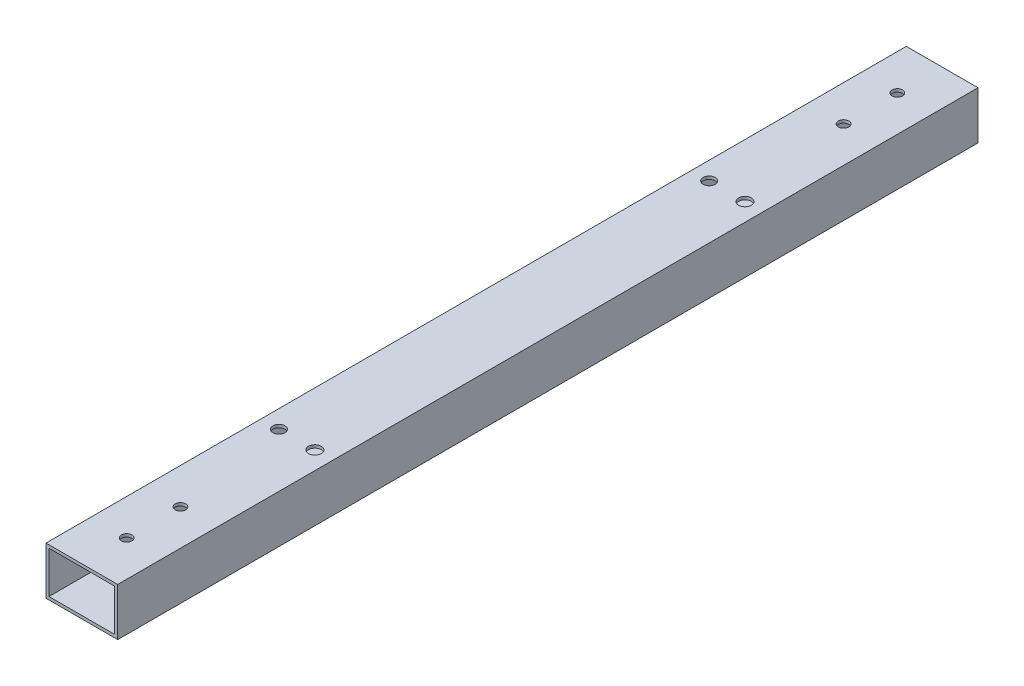
from build123d import *

# Parameters (mm, degrees)
BOSS_EXTRUDE1_DEPTH      = 457.2
BOSS_EXTRUDE1_DEPTH_BACK = 457.2
SKETCH3_W                = 76.2
SKETCH3_H                = 50.8
SKETCH3_W_2              = 69.85
SKETCH3_H_2              = 44.45
SKETCH6_R                = 6.394880264
SKETCH6_R_2              = 6.789577508
SKETCH6_R_3              = 5.5626
CUT_EXTRUDE1_DEPTH       = 462.588658873


with BuildPart() as part:
    # Sketch3 → Boss-Extrude1 (new, two sides: drawn at the far end of the back side and taken through both)
    with BuildSketch(Plane.XY.offset(-BOSS_EXTRUDE1_DEPTH_BACK)):
        Rectangle(SKETCH3_W, SKETCH3_H)
        Rectangle(SKETCH3_W_2, SKETCH3_H_2, mode=Mode.SUBTRACT)
    extrude(amount=BOSS_EXTRUDE1_DEPTH + BOSS_EXTRUDE1_DEPTH_BACK)

    # Sketch6 → Cut-Extrude1 (cut, through all)
    with BuildSketch(Plane(origin=(0, 25.4, 0), x_dir=(1, 0, 0), z_dir=(0, 1, 0))):
        with Locations(Location((-19.05, -228.6, 0), (0, 0, 270))):
            Circle(SKETCH6_R)
        with Locations(Location((19.05, -228.6, 0), (0, 0, 270))):
            Circle(SKETCH6_R_2)
        with Locations(Location((19.05, 228.6, 0), (0, 0, 270))):
            Circle(SKETCH6_R_2)
        with Locations(Location((-19.05, 228.6, 0), (0, 0, 270))):
            Circle(SKETCH6_R)
        with Locations(Location((0, -352.425, 0), (0, 0, 270))):
            Circle(SKETCH6_R_3)
        with Locations(Location((0, -409.575, 0), (0, 0, 270))):
            Circle(SKETCH6_R_3)
        with Locations(Location((0, 409.575, 0), (0, 0, 270))):
            Circle(SKETCH6_R_3)
        with Locations(Location((0, 352.425, 0), (0, 0, 270))):
            Circle(SKETCH6_R_3)
    extrude(amount=-CUT_EXTRUDE1_DEPTH, mode=Mode.SUBTRACT)


solid = part.part
